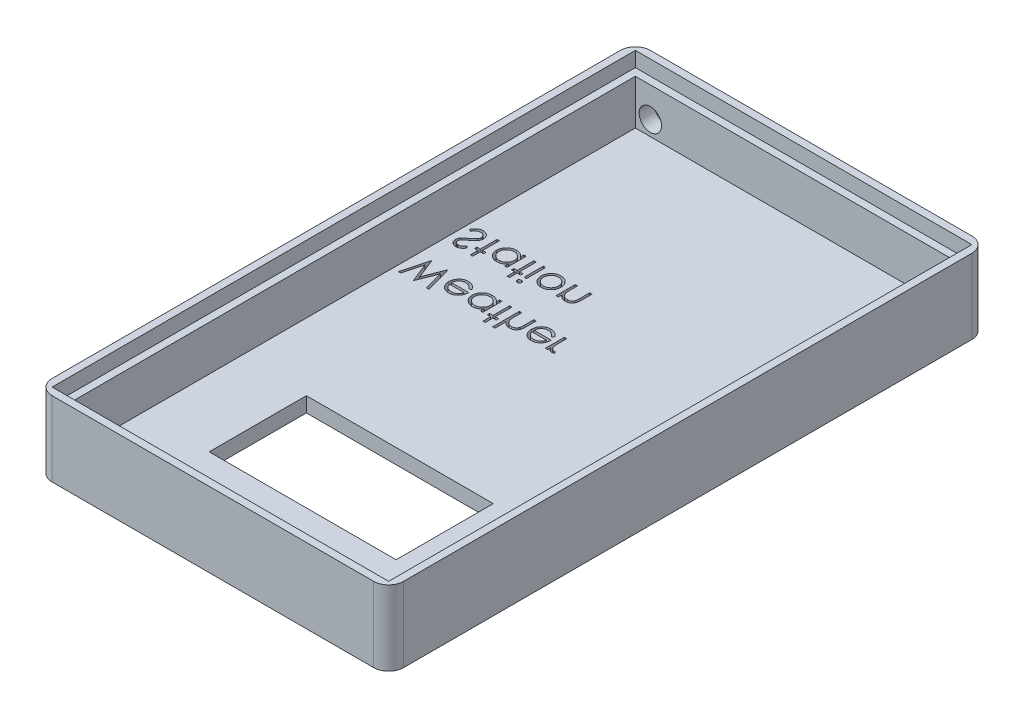
from build123d import *

# Parameters (mm, degrees)
SKETCH1_W           = 47
SKETCH1_H           = 80
BOSS_EXTRUDE1_DEPTH = 10
SKETCH2_W           = 43
SKETCH2_H           = 76
CUT_EXTRUDE1_DEPTH  = 8
SKETCH3_W           = 25
SKETCH3_H           = 13
CUT_EXTRUDE2_DEPTH  = 6
SKETCH4_W           = 45
SKETCH4_H           = 78
SKETCH4_W_2         = 43
SKETCH4_H_2         = 76
CUT_EXTRUDE3_DEPTH  = 2
SKETCH6_W           = 0.314102564
SKETCH6_H           = 2.557692307
CUT_EXTRUDE6_DEPTH  = 2
SKETCH7_R           = 1.5
CUT_EXTRUDE7_DEPTH  = 5
FILLET2_R           = 2


with BuildPart() as part:
    # Sketch1 → Boss-Extrude1 (new body)
    with BuildSketch(Plane(origin=(0, 0, 0), x_dir=(1, 0, 0), z_dir=(0, 1, 0))):
        Rectangle(SKETCH1_W, SKETCH1_H)
    extrude(amount=BOSS_EXTRUDE1_DEPTH)

    # Sketch2 → Cut-Extrude1 (cut)
    with BuildSketch(Plane(origin=(0, 10, 0), x_dir=(1, 0, 0), z_dir=(0, 1, 0))):
        Rectangle(SKETCH2_W, SKETCH2_H)
    extrude(amount=-CUT_EXTRUDE1_DEPTH, mode=Mode.SUBTRACT)

    # Sketch3 → Cut-Extrude2 (cut)
    with BuildSketch(Plane(origin=(0, 2, 0), x_dir=(1, 0, 0), z_dir=(0, 1, 0))):
        with Locations((0, -21.5)):
            Rectangle(SKETCH3_W, SKETCH3_H)
    extrude(amount=-CUT_EXTRUDE2_DEPTH, mode=Mode.SUBTRACT)

    # Sketch4 → Cut-Extrude3 (cut)
    with BuildSketch(Plane(origin=(0, 10, 0), x_dir=(1, 0, 0), z_dir=(0, 1, 0))):
        Rectangle(SKETCH4_W, SKETCH4_H)
        Rectangle(SKETCH4_W_2, SKETCH4_H_2, mode=Mode.SUBTRACT)
    extrude(amount=-CUT_EXTRUDE3_DEPTH, mode=Mode.SUBTRACT)

    # Sketch6 → Cut-Extrude6 (cut)
    # profile 1 of 15: a face of its own
    with BuildSketch(Plane.XZ):
        Polygon((-20.724451657, -5.515410878), (-20.400533388, -5.515410878), (-19.714836272, -8.084321134), (-18.696807426, -5.515410878), (-18.651234509, -5.515410878), (-17.650733708, -8.064689724), (-16.962232106, -5.515410878), (-16.641118323, -5.515410878), (-17.584828259, -9.015410878), (-17.629700054, -9.015410878), (-18.68278499, -6.339930109), (-19.747087875, -9.015410878), (-19.792660791, -9.015410878), align=None)
    # profile 2 of 15: a face of its own
    with BuildSketch(Plane.XZ):
        with BuildLine():
            Line((-14.003498131, -8.20771857), (-13.724451657, -8.354253025))
            add(Edge.make_bspline(
                [(-13.724451657, -8.354253025), (-13.746688252, -8.393696357), (-13.789951861, -8.47043746), (-13.864352608, -8.57586932), (-13.942344681, -8.670717036), (-14.027448649, -8.75244669), (-14.117118328, -8.823698075), (-14.211850983, -8.8860359), (-14.3121398, -8.93915442), (-14.417989525, -8.983906948), (-14.530289076, -9.018316442), (-14.649310593, -9.042620663), (-14.775282088, -9.057643932), (-14.861628268, -9.059389073), (-14.905841881, -9.060282673)],
                knots=[0, 0, 0, 0, 1.120438281, 2.179929193, 3.190490725, 4.156257408, 5.095198341, 6.022838206, 6.959905092, 7.901321166, 8.864066838, 9.862729781, 10.905609505, 12, 12, 12, 12], degree=3))
            add(Edge.make_bspline(
                [(-14.905841881, -9.060282673), (-14.954983859, -9.059135498), (-15.05084562, -9.056897691), (-15.190385367, -9.037605226), (-15.321764786, -9.006132868), (-15.444976489, -8.962167326), (-15.559718742, -8.904740002), (-15.666219597, -8.83478052), (-15.765039122, -8.752648266), (-15.853063332, -8.657631822), (-15.932307214, -8.555949865), (-16.002233034, -8.44999398), (-16.060690465, -8.340030756), (-16.108243076, -8.226760232), (-16.146647941, -8.110896338), (-16.173414644, -7.991384871), (-16.188844392, -7.868549287), (-16.191208838, -7.785451951), (-16.192400375, -7.743575942)],
                knots=[0, 0, 0, 0, 1.145258523, 2.234067595, 3.276747158, 4.290159414, 5.277019952, 6.260822364, 7.254936242, 8.264827045, 9.274100331, 10.257902744, 11.220704747, 12.172965371, 13.118907548, 14.062713208, 15.023725156, 16, 16, 16, 16], degree=3))
            add(Edge.make_bspline(
                [(-16.192400375, -7.743575942), (-16.191341233, -7.704281112), (-16.189242155, -7.626403947), (-16.176011368, -7.511138403), (-16.152563075, -7.39910995), (-16.120386751, -7.290225502), (-16.078835505, -7.184667368), (-16.028003285, -7.082371304), (-15.967810908, -6.983446165), (-15.921338234, -6.921043031), (-15.897929221, -6.889609596)],
                knots=[0, 0, 0, 0, 1.024358464, 2.0301432, 3.019427413, 4.004406732, 4.986367066, 5.972626655, 6.978780325, 8, 8, 8, 8], degree=3))
            add(Edge.make_bspline(
                [(-15.897929221, -6.889609596), (-15.866221538, -6.851740726), (-15.803810592, -6.777202575), (-15.698254236, -6.67926425), (-15.58395404, -6.597220474), (-15.462342414, -6.529213338), (-15.33200594, -6.477539691), (-15.194696649, -6.439032109), (-15.048851062, -6.417454098), (-14.949145842, -6.414406264), (-14.898129541, -6.412846775)],
                knots=[0, 0, 0, 0, 1.030682036, 2.02871468, 2.997146059, 3.962720338, 4.930598197, 5.918074684, 6.934738563, 8, 8, 8, 8], degree=3))
            add(Edge.make_bspline(
                [(-14.898129541, -6.412846775), (-14.845681936, -6.414200824), (-14.74279169, -6.41685716), (-14.592759569, -6.441483493), (-14.450798853, -6.480536048), (-14.316966348, -6.535689838), (-14.191248488, -6.60684939), (-14.074462438, -6.694991231), (-13.964610925, -6.797409319), (-13.900702347, -6.876172528), (-13.868181625, -6.916252224)],
                knots=[0, 0, 0, 0, 1.056321875, 2.072262726, 3.055038591, 4.01806755, 4.982017516, 5.957941055, 6.960871419, 8, 8, 8, 8], degree=3))
            add(Edge.make_bspline(
                [(-13.868181625, -6.916252224), (-13.846054686, -6.946455806), (-13.801948093, -7.006661924), (-13.746700993, -7.104833081), (-13.698743598, -7.207543676), (-13.660410637, -7.316453973), (-13.629371136, -7.430273553), (-13.606914317, -7.549816098), (-13.593744699, -7.675046009), (-13.591156001, -7.760372565), (-13.589836272, -7.803872417)],
                knots=[0, 0, 0, 0, 0.94817472, 1.890038105, 2.849395472, 3.817997239, 4.812318967, 5.836947057, 6.897266129, 8, 8, 8, 8], degree=3))
            Line((-13.589836272, -7.803872417), (-15.878297811, -7.803872417))
            add(Edge.make_bspline(
                [(-15.878297811, -7.803872417), (-15.876758204, -7.837572881), (-15.87373063, -7.903843484), (-15.859615487, -8.000814268), (-15.837366713, -8.09318761), (-15.806097651, -8.180270652), (-15.768230805, -8.263200779), (-15.721845089, -8.341362816), (-15.666505535, -8.414400746), (-15.604779835, -8.482967884), (-15.53607274, -8.544028645), (-15.463789993, -8.598680421), (-15.386896428, -8.644486018), (-15.305998344, -8.681665908), (-15.221226559, -8.710772224), (-15.132554364, -8.730640044), (-15.040156248, -8.743947151), (-14.977170514, -8.745426817), (-14.945104702, -8.746180109)],
                knots=[0, 0, 0, 0, 1.094153842, 2.151609401, 3.174256925, 4.172055639, 5.149267565, 6.128595816, 7.11444997, 8.118368179, 9.117203808, 10.09244225, 11.054858984, 12.015122123, 12.976791628, 13.957293641, 14.960065497, 16, 16, 16, 16], degree=3))
            add(Edge.make_bspline(
                [(-14.945104702, -8.746180109), (-14.913753554, -8.745572052), (-14.851546863, -8.744365551), (-14.758906006, -8.73263364), (-14.667766478, -8.713663365), (-14.578505495, -8.687773374), (-14.492934649, -8.656196522), (-14.413689099, -8.618093665), (-14.340808884, -8.575943918), (-14.272691917, -8.527734243), (-14.206620924, -8.468726056), (-14.141078437, -8.395090335), (-14.070801784, -8.308002807), (-14.026812191, -8.242457141), (-14.003498131, -8.20771857)],
                knots=[0, 0, 0, 0, 0.99110716, 1.966546729, 2.947904876, 3.932708344, 4.903319531, 5.828989031, 6.710028674, 7.56322171, 8.463672341, 9.504779593, 10.677557249, 12, 12, 12, 12], degree=3))
        make_face()
        with BuildLine():
            add(Edge.make_bspline(
                [(-13.903938836, -7.489769852), (-13.915435461, -7.448106979), (-13.937562762, -7.367919358), (-13.983799127, -7.256878468), (-14.035870667, -7.158190567), (-14.097492399, -7.072610934), (-14.167311124, -6.996607421), (-14.247956307, -6.930188835), (-14.338392201, -6.870771384), (-14.438151341, -6.820618885), (-14.543793126, -6.777929026), (-14.654399318, -6.74930391), (-14.767257106, -6.729694368), (-14.843591393, -6.72786826), (-14.88200374, -6.72694934)],
                knots=[0, 0, 0, 0, 1.154881502, 2.222775134, 3.210006277, 4.132804581, 5.035138423, 5.962687519, 6.919655026, 7.923214229, 8.944639381, 9.960483929, 10.97369054, 12, 12, 12, 12], degree=3))
            add(Edge.make_bspline(
                [(-14.88200374, -6.72694934), (-14.913353179, -6.727561011), (-14.975324428, -6.728770157), (-15.066625496, -6.740240287), (-15.154305195, -6.759200131), (-15.239010482, -6.785165088), (-15.319631351, -6.81977369), (-15.397826119, -6.860356917), (-15.471606515, -6.909898501), (-15.517747811, -6.947657356), (-15.541058227, -6.966732993)],
                knots=[0, 0, 0, 0, 1.04873581, 2.073130211, 3.073294108, 4.04793562, 5.032784715, 6.005352987, 6.992311501, 8, 8, 8, 8], degree=3))
            add(Edge.make_bspline(
                [(-15.541058227, -6.966732993), (-15.557751509, -6.981827309), (-15.591534644, -7.012374525), (-15.636675165, -7.065003732), (-15.679895638, -7.121755294), (-15.71922929, -7.184800418), (-15.755306877, -7.253421197), (-15.789066854, -7.327038833), (-15.819453266, -7.406211963), (-15.836549376, -7.461384402), (-15.845345086, -7.489769852)],
                knots=[0, 0, 0, 0, 0.879870761, 1.780643979, 2.707998968, 3.669668524, 4.684282772, 5.740141944, 6.837334558, 8, 8, 8, 8], degree=3))
            Line((-15.845345086, -7.489769852), (-13.903938836, -7.489769852))
        make_face(mode=Mode.SUBTRACT)
    # profile 3 of 15: a face of its own
    with BuildSketch(Plane.XZ):
        with BuildLine():
            Line((-10.359067041, -6.45771857), (-10.359067041, -9.015410878))
            Line((-10.359067041, -9.015410878), (-10.673169606, -9.015410878))
            Line((-10.673169606, -9.015410878), (-10.673169606, -8.573003025))
            add(Edge.make_bspline(
                [(-10.673169606, -8.573003025), (-10.708588396, -8.613042619), (-10.777708611, -8.691180391), (-10.893149729, -8.793262563), (-11.015517907, -8.877640885), (-11.144219228, -8.9457908), (-11.279137472, -8.996982857), (-11.419973559, -9.033369016), (-11.56678494, -9.056762851), (-11.667037295, -9.059098873), (-11.71784108, -9.060282673)],
                knots=[0, 0, 0, 0, 1.074387032, 2.096679803, 3.090159297, 4.057316773, 5.018401886, 5.985159533, 6.978961417, 8, 8, 8, 8], degree=3))
            add(Edge.make_bspline(
                [(-11.71784108, -9.060282673), (-11.763009034, -9.059056301), (-11.852082239, -9.05663784), (-11.983111316, -9.037875537), (-12.109203565, -9.007744915), (-12.230478138, -8.965844025), (-12.346150283, -8.910263204), (-12.45721038, -8.843721956), (-12.563083072, -8.764481126), (-12.662154611, -8.673893097), (-12.753386611, -8.57549811), (-12.833447884, -8.470552563), (-12.900200964, -8.359510259), (-12.956021045, -8.243777106), (-12.999017389, -8.122462186), (-13.028991023, -7.995985018), (-13.04773147, -7.864495145), (-13.050148931, -7.774955621), (-13.051374734, -7.729553506)],
                knots=[0, 0, 0, 0, 1.033919861, 2.038935746, 3.024066025, 3.998881131, 4.97069526, 5.957263378, 6.95902576, 7.993208707, 9.027059324, 10.027763471, 11.009749337, 11.988697705, 12.965288445, 13.950418724, 14.960734635, 16, 16, 16, 16], degree=3))
            add(Edge.make_bspline(
                [(-13.051374734, -7.729553506), (-13.050121762, -7.685089803), (-13.047644706, -7.597187459), (-13.029191486, -7.467908761), (-12.998160477, -7.343390501), (-12.954612629, -7.224033557), (-12.898770674, -7.109693507), (-12.830842587, -7.000289482), (-12.750823463, -6.895520085), (-12.658571056, -6.797848858), (-12.558636285, -6.707628244), (-12.451727555, -6.629219198), (-12.340504273, -6.561502349), (-12.223241263, -6.507848873), (-12.101674158, -6.464439769), (-11.974720712, -6.4344068), (-11.842909133, -6.416709479), (-11.753418641, -6.414146715), (-11.708025375, -6.412846775)],
                knots=[0, 0, 0, 0, 1.020392517, 2.01726096, 2.990465484, 3.961182959, 4.928053699, 5.906110375, 6.912531644, 7.948652711, 8.985773172, 9.998621852, 10.987621588, 11.969261332, 12.953316658, 13.946091881, 14.958173133, 16, 16, 16, 16], degree=3))
            add(Edge.make_bspline(
                [(-11.708025375, -6.412846775), (-11.655825516, -6.414284527), (-11.553464056, -6.41710389), (-11.403736046, -6.440566617), (-11.262091569, -6.480205084), (-11.127437217, -6.534122582), (-11.00025653, -6.605771312), (-10.881753546, -6.696151273), (-10.770688063, -6.80469246), (-10.706307771, -6.888062904), (-10.673169606, -6.930975782)],
                knots=[0, 0, 0, 0, 1.038897134, 2.037228247, 3.008116434, 3.962042015, 4.918381754, 5.904844433, 6.921570401, 8, 8, 8, 8], degree=3))
            Line((-10.673169606, -6.930975782), (-10.673169606, -6.45771857))
            Line((-10.673169606, -6.45771857), (-10.359067041, -6.45771857))
        make_face()
        with BuildLine():
            add(Edge.make_bspline(
                [(-11.703818644, -6.72694934), (-11.749732982, -6.728582977), (-11.840360582, -6.731807518), (-11.973404584, -6.756981014), (-12.100717998, -6.798865608), (-12.221664072, -6.856147509), (-12.334332289, -6.928176246), (-12.43502596, -7.015297629), (-12.524568661, -7.115134643), (-12.599876925, -7.227236754), (-12.661267422, -7.347414845), (-12.704434454, -7.473039283), (-12.732903702, -7.60184426), (-12.735812222, -7.689206946), (-12.73727217, -7.733059115)],
                knots=[0, 0, 0, 0, 1.031046209, 2.035121221, 3.029706178, 4.034933723, 5.034054252, 6.02443088, 7.017295772, 8.038157696, 9.050218397, 10.03989886, 11.016116709, 12, 12, 12, 12], degree=3))
            add(Edge.make_bspline(
                [(-12.73727217, -7.733059115), (-12.735407276, -7.776649222), (-12.731684799, -7.863658578), (-12.704934105, -7.992639155), (-12.660054232, -8.118293197), (-12.598812169, -8.239554191), (-12.522125544, -8.352138291), (-12.433236892, -8.453878414), (-12.33128661, -8.541368002), (-12.218359103, -8.614605575), (-12.097751133, -8.673768096), (-11.970917201, -8.714933736), (-11.840241563, -8.741511516), (-11.751389229, -8.744615993), (-11.706623131, -8.746180109)],
                knots=[0, 0, 0, 0, 0.979072187, 1.954306742, 2.945804271, 3.96968567, 4.997920485, 5.998718438, 6.996577872, 8.005894225, 9.015743152, 10.005417472, 10.995077863, 12, 12, 12, 12], degree=3))
            add(Edge.make_bspline(
                [(-11.706623131, -8.746180109), (-11.661176628, -8.744520145), (-11.570788042, -8.741218641), (-11.437349334, -8.715937376), (-11.307854371, -8.674168578), (-11.184067143, -8.616269451), (-11.068751012, -8.544512095), (-10.965253134, -8.460505004), (-10.877737166, -8.36280182), (-10.803544556, -8.255425367), (-10.745369139, -8.13771337), (-10.70299308, -8.01237918), (-10.677939174, -7.879418431), (-10.674781445, -7.788554504), (-10.673169606, -7.742173699)],
                knots=[0, 0, 0, 0, 1.01762866, 2.023962475, 3.030623092, 4.058876274, 5.077231937, 6.066672613, 7.034107872, 8.005628644, 8.981990164, 9.965428785, 10.961468474, 12, 12, 12, 12], degree=3))
            add(Edge.make_bspline(
                [(-10.673169606, -7.742173699), (-10.674129262, -7.706835868), (-10.676018169, -7.637279835), (-10.690448739, -7.535152317), (-10.713403665, -7.437418591), (-10.745749835, -7.343975902), (-10.78824112, -7.255340887), (-10.839488886, -7.170877126), (-10.900394335, -7.091023915), (-10.969977031, -7.016880844), (-11.046142234, -6.949254382), (-11.126736775, -6.888890141), (-11.212715522, -6.839301368), (-11.302632558, -6.798260097), (-11.396643893, -6.765600947), (-11.495514513, -6.743813253), (-11.5981935, -6.728852932), (-11.668239555, -6.727590551), (-11.703818644, -6.72694934)],
                knots=[0, 0, 0, 0, 1.050140795, 2.067009409, 3.05949893, 4.030605086, 5.00011959, 5.97591094, 6.962425594, 7.979863591, 8.993523472, 9.986985069, 10.967611495, 11.937549037, 12.921786183, 13.919465291, 14.943216303, 16, 16, 16, 16], degree=3))
        make_face(mode=Mode.SUBTRACT)
    # profile 4 of 15: a face of its own
    with BuildSketch(Plane.XZ):
        Polygon((-9.327015759, -5.425667288), (-9.012913195, -5.425667288), (-9.012913195, -6.45771857), (-8.564195247, -6.45771857), (-8.564195247, -6.771821134), (-9.012913195, -6.771821134), (-9.012913195, -9.015410878), (-9.327015759, -9.015410878), (-9.327015759, -6.771821134), (-9.775733708, -6.771821134), (-9.775733708, -6.45771857), (-9.327015759, -6.45771857), align=None)
    # profile 5 of 15: a face of its own
    with BuildSketch(Plane.XZ):
        with BuildLine():
            Line((-8.025733708, -5.425667288), (-7.711631144, -5.425667288))
            Line((-7.711631144, -5.425667288), (-7.711631144, -6.940791487))
            add(Edge.make_bspline(
                [(-7.711631144, -6.940791487), (-7.677913842, -6.898647505), (-7.612264528, -6.816591012), (-7.501768412, -6.709529821), (-7.38829754, -6.6167312), (-7.26793273, -6.542860743), (-7.142882209, -6.4845042), (-7.012618565, -6.443116553), (-6.877117594, -6.417665457), (-6.785092444, -6.414467039), (-6.738474093, -6.412846775)],
                knots=[0, 0, 0, 0, 1.125788106, 2.19196713, 3.20547328, 4.180437432, 5.132270164, 6.079753143, 7.027236121, 8, 8, 8, 8], degree=3))
            add(Edge.make_bspline(
                [(-6.738474093, -6.412846775), (-6.6911437, -6.414592206), (-6.598506704, -6.418008434), (-6.463625242, -6.445021815), (-6.337664367, -6.491179253), (-6.220998524, -6.554346278), (-6.116173827, -6.633019105), (-6.023324063, -6.723850628), (-5.947483264, -6.829124546), (-5.895884147, -6.9263808), (-5.862310739, -7.012919554), (-5.841058913, -7.087156066), (-5.823039714, -7.169877979), (-5.807339979, -7.261042712), (-5.796876397, -7.361087883), (-5.788471779, -7.469562138), (-5.782495325, -7.586459256), (-5.78226372, -7.667379505), (-5.782143965, -7.709220974)],
                knots=[0, 0, 0, 0, 1.235656852, 2.418478516, 3.575258207, 4.727955599, 5.870717718, 6.98870536, 8.107142894, 9.245821548, 9.854588956, 10.528768408, 11.260415777, 12.065282286, 12.943670737, 13.886611085, 14.907229059, 16, 16, 16, 16], degree=3))
            Line((-5.782143965, -7.709220974), (-5.782143965, -9.015410878))
            Line((-5.782143965, -9.015410878), (-6.096246529, -9.015410878))
            Line((-6.096246529, -9.015410878), (-6.096246529, -7.812285878))
            add(Edge.make_bspline(
                [(-6.096246529, -7.812285878), (-6.096436832, -7.777463209), (-6.096800849, -7.710853368), (-6.098004194, -7.61548726), (-6.100690409, -7.528991125), (-6.105031235, -7.451642173), (-6.109596542, -7.38333257), (-6.11587986, -7.324161516), (-6.123190094, -7.27404774), (-6.129758875, -7.243883112), (-6.132704862, -7.230354788)],
                knots=[0, 0, 0, 0, 1.430932559, 2.737130458, 3.918967929, 4.986496826, 5.920444988, 6.731744033, 7.431208747, 8, 8, 8, 8], degree=3))
            add(Edge.make_bspline(
                [(-6.132704862, -7.230354788), (-6.144129107, -7.190660525), (-6.166092152, -7.114348534), (-6.217140129, -7.010686124), (-6.28089914, -6.922301383), (-6.358746402, -6.850387095), (-6.449304766, -6.793975556), (-6.55316473, -6.754907773), (-6.669348798, -6.730660051), (-6.75120027, -6.728220748), (-6.793862715, -6.72694934)],
                knots=[0, 0, 0, 0, 1.090059168, 2.095632401, 3.037101401, 3.955032261, 4.878929692, 5.839099886, 6.873700383, 8, 8, 8, 8], degree=3))
            add(Edge.make_bspline(
                [(-6.793862715, -6.72694934), (-6.819130488, -6.727425166), (-6.869134758, -6.728366814), (-6.943283424, -6.737820712), (-7.015212487, -6.753269431), (-7.085614665, -6.77417397), (-7.152997863, -6.802619506), (-7.219326188, -6.835549696), (-7.282720397, -6.875857951), (-7.344306214, -6.921083718), (-7.401623747, -6.971153478), (-7.454950862, -7.024000433), (-7.502489203, -7.080275397), (-7.545557794, -7.139075513), (-7.582736079, -7.201207306), (-7.615189161, -7.266071625), (-7.642724858, -7.33375377), (-7.65640755, -7.380728832), (-7.66325374, -7.404232993)],
                knots=[0, 0, 0, 0, 1.024319606, 2.027102035, 3.025350316, 4.005802111, 5.00026367, 5.987881639, 7.005602596, 8.042517216, 9.083927026, 10.089214625, 11.084353441, 12.06828073, 13.041928858, 14.016821737, 15.00770877, 16, 16, 16, 16], degree=3))
            add(Edge.make_bspline(
                [(-7.66325374, -7.404232993), (-7.667193167, -7.421253944), (-7.675777664, -7.458344691), (-7.685092497, -7.519519015), (-7.693430294, -7.590605387), (-7.700478844, -7.671495988), (-7.70480193, -7.76248723), (-7.709460171, -7.862958189), (-7.711194185, -7.97353821), (-7.711481138, -8.050433717), (-7.711631144, -8.090631231)],
                knots=[0, 0, 0, 0, 0.607992626, 1.324890765, 2.152360218, 3.099583803, 4.150613268, 5.323148443, 6.60066238, 8, 8, 8, 8], degree=3))
            Line((-7.711631144, -8.090631231), (-7.711631144, -9.015410878))
            Line((-7.711631144, -9.015410878), (-8.025733708, -9.015410878))
            Line((-8.025733708, -9.015410878), (-8.025733708, -5.425667288))
        make_face()
    # profile 6 of 15: a face of its own
    with BuildSketch(Plane.XZ):
        with BuildLine():
            Line((-2.965036593, -8.20771857), (-2.685990118, -8.354253025))
            add(Edge.make_bspline(
                [(-2.685990118, -8.354253025), (-2.708226714, -8.393696357), (-2.751490322, -8.47043746), (-2.82589107, -8.57586932), (-2.903883143, -8.670717036), (-2.988987111, -8.75244669), (-3.078656789, -8.823698075), (-3.173389444, -8.8860359), (-3.273678262, -8.93915442), (-3.379527987, -8.983906948), (-3.491827538, -9.018316442), (-3.610849054, -9.042620663), (-3.73682055, -9.057643932), (-3.82316673, -9.059389073), (-3.867380343, -9.060282673)],
                knots=[0, 0, 0, 0, 1.120438281, 2.179929193, 3.190490725, 4.156257408, 5.095198341, 6.022838206, 6.959905092, 7.901321166, 8.864066838, 9.862729781, 10.905609505, 12, 12, 12, 12], degree=3))
            add(Edge.make_bspline(
                [(-3.867380343, -9.060282673), (-3.91652232, -9.059135498), (-4.012384082, -9.056897691), (-4.151923829, -9.037605226), (-4.283303247, -9.006132868), (-4.406514951, -8.962167326), (-4.521257203, -8.904740002), (-4.627758058, -8.83478052), (-4.726577584, -8.752648266), (-4.814601793, -8.657631822), (-4.893845676, -8.555949865), (-4.963771496, -8.44999398), (-5.022228927, -8.340030756), (-5.069781537, -8.226760232), (-5.108186402, -8.110896338), (-5.134953106, -7.991384871), (-5.150382854, -7.868549287), (-5.152747299, -7.785451951), (-5.153938836, -7.743575942)],
                knots=[0, 0, 0, 0, 1.145258523, 2.234067595, 3.276747158, 4.290159414, 5.277019952, 6.260822364, 7.254936242, 8.264827045, 9.274100331, 10.257902744, 11.220704747, 12.172965371, 13.118907548, 14.062713208, 15.023725156, 16, 16, 16, 16], degree=3))
            add(Edge.make_bspline(
                [(-5.153938836, -7.743575942), (-5.152879695, -7.704281112), (-5.150780617, -7.626403947), (-5.137549829, -7.511138403), (-5.114101536, -7.39910995), (-5.081925212, -7.290225502), (-5.040373966, -7.184667368), (-4.989541747, -7.082371304), (-4.929349369, -6.983446165), (-4.882876695, -6.921043031), (-4.859467682, -6.889609596)],
                knots=[0, 0, 0, 0, 1.024358464, 2.0301432, 3.019427413, 4.004406732, 4.986367066, 5.972626655, 6.978780325, 8, 8, 8, 8], degree=3))
            add(Edge.make_bspline(
                [(-4.859467682, -6.889609596), (-4.82776, -6.851740726), (-4.765349053, -6.777202575), (-4.659792698, -6.67926425), (-4.545492501, -6.597220474), (-4.423880875, -6.529213338), (-4.293544401, -6.477539691), (-4.15623511, -6.439032109), (-4.010389524, -6.417454098), (-3.910684303, -6.414406264), (-3.859668003, -6.412846775)],
                knots=[0, 0, 0, 0, 1.030682036, 2.02871468, 2.997146059, 3.962720338, 4.930598197, 5.918074684, 6.934738563, 8, 8, 8, 8], degree=3))
            add(Edge.make_bspline(
                [(-3.859668003, -6.412846775), (-3.807220398, -6.414200824), (-3.704330152, -6.41685716), (-3.554298031, -6.441483493), (-3.412337314, -6.480536048), (-3.27850481, -6.535689838), (-3.152786949, -6.60684939), (-3.0360009, -6.694991231), (-2.926149387, -6.797409319), (-2.862240808, -6.876172528), (-2.829720086, -6.916252224)],
                knots=[0, 0, 0, 0, 1.056321875, 2.072262726, 3.055038591, 4.01806755, 4.982017516, 5.957941055, 6.960871419, 8, 8, 8, 8], degree=3))
            add(Edge.make_bspline(
                [(-2.829720086, -6.916252224), (-2.807593148, -6.946455806), (-2.763486555, -7.006661924), (-2.708239455, -7.104833081), (-2.66028206, -7.207543676), (-2.621949099, -7.316453973), (-2.590909598, -7.430273553), (-2.568452779, -7.549816098), (-2.55528316, -7.675046009), (-2.552694463, -7.760372565), (-2.551374734, -7.803872417)],
                knots=[0, 0, 0, 0, 0.94817472, 1.890038105, 2.849395472, 3.817997239, 4.812318967, 5.836947057, 6.897266129, 8, 8, 8, 8], degree=3))
            Line((-2.551374734, -7.803872417), (-4.839836272, -7.803872417))
            add(Edge.make_bspline(
                [(-4.839836272, -7.803872417), (-4.838296666, -7.837572881), (-4.835269092, -7.903843484), (-4.821153949, -8.000814268), (-4.798905175, -8.09318761), (-4.767636112, -8.180270652), (-4.729769267, -8.263200779), (-4.68338355, -8.341362816), (-4.628043996, -8.414400746), (-4.566318297, -8.482967884), (-4.497611202, -8.544028645), (-4.425328454, -8.598680421), (-4.348434889, -8.644486018), (-4.267536806, -8.681665908), (-4.182765021, -8.710772224), (-4.094092826, -8.730640044), (-4.001694709, -8.743947151), (-3.938708975, -8.745426817), (-3.906643163, -8.746180109)],
                knots=[0, 0, 0, 0, 1.094153842, 2.151609401, 3.174256925, 4.172055639, 5.149267565, 6.128595816, 7.11444997, 8.118368179, 9.117203808, 10.09244225, 11.054858984, 12.015122123, 12.976791628, 13.957293641, 14.960065497, 16, 16, 16, 16], degree=3))
            add(Edge.make_bspline(
                [(-3.906643163, -8.746180109), (-3.875292016, -8.745572052), (-3.813085325, -8.744365551), (-3.720444467, -8.73263364), (-3.62930494, -8.713663365), (-3.540043957, -8.687773374), (-3.454473111, -8.656196522), (-3.375227561, -8.618093665), (-3.302347345, -8.575943918), (-3.234230378, -8.527734243), (-3.168159385, -8.468726056), (-3.102616899, -8.395090335), (-3.032340245, -8.308002807), (-2.988350653, -8.242457141), (-2.965036593, -8.20771857)],
                knots=[0, 0, 0, 0, 0.99110716, 1.966546729, 2.947904876, 3.932708344, 4.903319531, 5.828989031, 6.710028674, 7.56322171, 8.463672341, 9.504779593, 10.677557249, 12, 12, 12, 12], degree=3))
        make_face()
        with BuildLine():
            add(Edge.make_bspline(
                [(-2.865477298, -7.489769852), (-2.876973922, -7.448106979), (-2.899101224, -7.367919358), (-2.945337588, -7.256878468), (-2.997409129, -7.158190567), (-3.05903086, -7.072610934), (-3.128849586, -6.996607421), (-3.209494769, -6.930188835), (-3.299930662, -6.870771384), (-3.399689803, -6.820618885), (-3.505331588, -6.777929026), (-3.61593778, -6.74930391), (-3.728795568, -6.729694368), (-3.805129854, -6.72786826), (-3.843542202, -6.72694934)],
                knots=[0, 0, 0, 0, 1.154881502, 2.222775134, 3.210006277, 4.132804581, 5.035138423, 5.962687519, 6.919655026, 7.923214229, 8.944639381, 9.960483929, 10.97369054, 12, 12, 12, 12], degree=3))
            add(Edge.make_bspline(
                [(-3.843542202, -6.72694934), (-3.87489164, -6.727561011), (-3.936862889, -6.728770157), (-4.028163957, -6.740240287), (-4.115843656, -6.759200131), (-4.200548944, -6.785165088), (-4.281169812, -6.81977369), (-4.359364581, -6.860356917), (-4.433144977, -6.909898501), (-4.479286272, -6.947657356), (-4.502596689, -6.966732993)],
                knots=[0, 0, 0, 0, 1.04873581, 2.073130211, 3.073294108, 4.04793562, 5.032784715, 6.005352987, 6.992311501, 8, 8, 8, 8], degree=3))
            add(Edge.make_bspline(
                [(-4.502596689, -6.966732993), (-4.519289971, -6.981827309), (-4.553073105, -7.012374525), (-4.598213627, -7.065003732), (-4.641434099, -7.121755294), (-4.680767752, -7.184800418), (-4.716845338, -7.253421197), (-4.750605316, -7.327038833), (-4.780991728, -7.406211963), (-4.798087838, -7.461384402), (-4.806883548, -7.489769852)],
                knots=[0, 0, 0, 0, 0.879870761, 1.780643979, 2.707998968, 3.669668524, 4.684282772, 5.740141944, 6.837334558, 8, 8, 8, 8], degree=3))
            Line((-4.806883548, -7.489769852), (-2.865477298, -7.489769852))
        make_face(mode=Mode.SUBTRACT)
    # profile 7 of 15: a face of its own
    with BuildSketch(Plane.XZ):
        with BuildLine():
            Line((-2.012913195, -6.45771857), (-1.698810631, -6.45771857))
            Line((-1.698810631, -6.45771857), (-1.698810631, -6.834220974))
            add(Edge.make_bspline(
                [(-1.698810631, -6.834220974), (-1.675621872, -6.799165146), (-1.631273551, -6.732121147), (-1.557560622, -6.643451846), (-1.482057291, -6.570036799), (-1.404402104, -6.51153328), (-1.324024004, -6.467720161), (-1.242687052, -6.435627126), (-1.159111582, -6.416649811), (-1.102949658, -6.414116152), (-1.074812234, -6.412846775)],
                knots=[0, 0, 0, 0, 1.2804753, 2.448899062, 3.506932113, 4.484331642, 5.4025378, 6.288909075, 7.142734305, 8, 8, 8, 8], degree=3))
            add(Edge.make_bspline(
                [(-1.074812234, -6.412846775), (-1.052985907, -6.414037302), (-1.008076822, -6.416486888), (-0.940094232, -6.433697713), (-0.87005078, -6.461175735), (-0.824908393, -6.487015958), (-0.801374734, -6.500487)],
                knots=[0, 0, 0, 0, 0.901110191, 1.854092781, 2.881294221, 4, 4, 4, 4], degree=3))
            Line((-0.801374734, -6.500487), (-0.973850695, -6.772522256))
            add(Edge.make_bspline(
                [(-0.973850695, -6.772522256), (-0.988959716, -6.76578199), (-1.017639531, -6.752987675), (-1.059594097, -6.737845665), (-1.098275434, -6.728929749), (-1.122918992, -6.727579031), (-1.134407586, -6.72694934)],
                knots=[0, 0, 0, 0, 1.180555205, 2.24091978, 3.179933427, 4, 4, 4, 4], degree=3))
            add(Edge.make_bspline(
                [(-1.134407586, -6.72694934), (-1.15961332, -6.728629377), (-1.21102571, -6.732056166), (-1.286510209, -6.758994974), (-1.359757415, -6.802520214), (-1.417929077, -6.850791326), (-1.46297133, -6.897339123), (-1.495111555, -6.937987526), (-1.524594302, -6.983566157), (-1.552764523, -7.033295841), (-1.578430817, -7.088025687), (-1.602385486, -7.147208901), (-1.624044349, -7.21091403), (-1.636394593, -7.25529655), (-1.642720888, -7.27803107)],
                knots=[0, 0, 0, 0, 1.125678352, 2.296057538, 3.5422874, 4.923748041, 5.663163013, 6.437101912, 7.23742474, 8.08941207, 8.991984279, 9.93940061, 10.944477711, 12, 12, 12, 12], degree=3))
            add(Edge.make_bspline(
                [(-1.642720888, -7.27803107), (-1.647453281, -7.298308244), (-1.657935173, -7.343220643), (-1.66812671, -7.418569167), (-1.678196228, -7.507592826), (-1.685292847, -7.610539419), (-1.691870889, -7.727151863), (-1.695580971, -7.857607808), (-1.698684112, -8.00204116), (-1.698767179, -8.103015513), (-1.698810631, -8.155835558)],
                knots=[0, 0, 0, 0, 0.566838948, 1.255505196, 2.06880316, 3.007127437, 4.065329342, 5.249902469, 6.561414163, 8, 8, 8, 8], degree=3))
            Line((-1.698810631, -8.155835558), (-1.698810631, -9.015410878))
            Line((-1.698810631, -9.015410878), (-2.012913195, -9.015410878))
            Line((-2.012913195, -9.015410878), (-2.012913195, -6.45771857))
        make_face()
    # profile 8 of 15: a face of its own
    with BuildSketch(Plane.XZ):
        with BuildLine():
            Line((-20.859067041, -15.173563923), (-20.563193644, -14.996180109))
            add(Edge.make_bspline(
                [(-20.563193644, -14.996180109), (-20.535675407, -15.042244494), (-20.482951526, -15.130502078), (-20.395000167, -15.249760118), (-20.303867256, -15.351122275), (-20.208877922, -15.433998882), (-20.110611974, -15.499247769), (-20.00842792, -15.545450001), (-19.90267011, -15.574265976), (-19.830696288, -15.577766063), (-19.794764157, -15.579513442)],
                knots=[0, 0, 0, 0, 1.272034388, 2.437168799, 3.508375237, 4.49857839, 5.41946034, 6.295179144, 7.148887113, 8, 8, 8, 8], degree=3))
            add(Edge.make_bspline(
                [(-19.794764157, -15.579513442), (-19.764077296, -15.57865877), (-19.703240523, -15.576964379), (-19.61367828, -15.560683577), (-19.526696478, -15.535671448), (-19.44408784, -15.499850517), (-19.366992226, -15.456512031), (-19.29938553, -15.404165854), (-19.240939417, -15.345559648), (-19.193130303, -15.280176993), (-19.156450267, -15.209859845), (-19.128258199, -15.137683893), (-19.112613125, -15.062515325), (-19.110256372, -15.011904862), (-19.109067041, -14.986364404)],
                knots=[0, 0, 0, 0, 1.095163259, 2.171163733, 3.241058638, 4.321873601, 5.38011039, 6.391990106, 7.366004449, 8.327778327, 9.272591725, 10.192022065, 11.087607919, 12, 12, 12, 12], degree=3))
            add(Edge.make_bspline(
                [(-19.109067041, -14.986364404), (-19.110541352, -14.957223554), (-19.11353841, -14.897984465), (-19.13886989, -14.810584812), (-19.178719137, -14.724092242), (-19.215481781, -14.670590976), (-19.234567843, -14.642814724)],
                knots=[0, 0, 0, 0, 0.938893495, 1.908633276, 2.914225137, 4, 4, 4, 4], degree=3))
            add(Edge.make_bspline(
                [(-19.234567843, -14.642814724), (-19.250238457, -14.622767901), (-19.283136951, -14.580682102), (-19.339694464, -14.518036867), (-19.406060578, -14.453418448), (-19.479964133, -14.384359391), (-19.564097222, -14.314071594), (-19.655824736, -14.239203316), (-19.757488595, -14.162601739), (-19.828788092, -14.111229173), (-19.865577458, -14.084721775)],
                knots=[0, 0, 0, 0, 0.722233717, 1.516239348, 2.393582979, 3.351407094, 4.387010283, 5.505090956, 6.712668013, 8, 8, 8, 8], degree=3))
            add(Edge.make_bspline(
                [(-19.865577458, -14.084721775), (-19.902401454, -14.058493188), (-19.972806131, -14.008346126), (-20.071264713, -13.933921842), (-20.159309176, -13.865877972), (-20.236548193, -13.80357396), (-20.30294779, -13.747001355), (-20.359031201, -13.696703416), (-20.403369758, -13.651319855), (-20.428025338, -13.621878513), (-20.439095086, -13.608660077)],
                knots=[0, 0, 0, 0, 1.452282411, 2.77665338, 3.964542531, 5.026858415, 5.96415736, 6.766646006, 7.446254459, 8, 8, 8, 8], degree=3))
            add(Edge.make_bspline(
                [(-20.439095086, -13.608660077), (-20.454567632, -13.58805904), (-20.484996468, -13.547544336), (-20.525162474, -13.484219478), (-20.559301637, -13.419396213), (-20.586063969, -13.352900348), (-20.608600187, -13.28566542), (-20.623758118, -13.216814174), (-20.633249515, -13.146655555), (-20.634221502, -13.099442055), (-20.634708067, -13.075807513)],
                knots=[0, 0, 0, 0, 1.068054152, 2.10047183, 3.106115577, 4.101338837, 5.06977816, 6.043150881, 7.020423561, 8, 8, 8, 8], degree=3))
            add(Edge.make_bspline(
                [(-20.634708067, -13.075807513), (-20.633402858, -13.038777738), (-20.630820338, -12.965509674), (-20.608979821, -12.858478844), (-20.574506927, -12.756292427), (-20.526212039, -12.659962093), (-20.463954686, -12.571996112), (-20.391908712, -12.491382625), (-20.306097226, -12.423614043), (-20.211944602, -12.364401984), (-20.10888823, -12.318056059), (-20.000897327, -12.283095079), (-19.887800255, -12.263285821), (-19.81119712, -12.260443057), (-19.772328259, -12.259000622)],
                knots=[0, 0, 0, 0, 1.005424448, 1.989358655, 2.955360095, 3.929531133, 4.905563448, 5.876582895, 6.856512386, 7.866279853, 8.892233794, 9.918561126, 10.94386622, 12, 12, 12, 12], degree=3))
            add(Edge.make_bspline(
                [(-19.772328259, -12.259000622), (-19.731084159, -12.260423173), (-19.649062807, -12.263252174), (-19.528413592, -12.287849706), (-19.412252875, -12.328550377), (-19.318809611, -12.374739035), (-19.245676849, -12.420870451), (-19.189904116, -12.462890275), (-19.133386666, -12.511265384), (-19.075668611, -12.56612463), (-19.017727951, -12.627971381), (-18.958704499, -12.69638207), (-18.89846023, -12.770938626), (-18.85970437, -12.824163127), (-18.839836272, -12.851448538)],
                knots=[0, 0, 0, 0, 1.286793592, 2.559021753, 3.825965368, 5.121522368, 5.803751409, 6.523245864, 7.299691795, 8.125521123, 9.008227632, 9.944561021, 10.946284179, 12, 12, 12, 12], degree=3))
            Line((-18.839836272, -12.851448538), (-19.123790599, -13.066692929))
            add(Edge.make_bspline(
                [(-19.123790599, -13.066692929), (-19.140936532, -13.044604239), (-19.173955589, -13.002066586), (-19.224085076, -12.94249527), (-19.271333723, -12.888078791), (-19.317884123, -12.840813663), (-19.361277755, -12.798111529), (-19.403394797, -12.761551772), (-19.443629148, -12.730776177), (-19.494346059, -12.697932617), (-19.558063777, -12.665376113), (-19.638048313, -12.637827035), (-19.721634588, -12.621271973), (-19.77856422, -12.619083086), (-19.807384349, -12.617974981)],
                knots=[0, 0, 0, 0, 1.181633172, 2.275549214, 3.290209073, 4.226197932, 5.078386478, 5.862611352, 6.581680152, 7.217281963, 8.414376989, 9.595101626, 10.782541182, 12, 12, 12, 12], degree=3))
            add(Edge.make_bspline(
                [(-19.807384349, -12.617974981), (-19.843540872, -12.619186681), (-19.913265319, -12.62152333), (-20.012255555, -12.647043315), (-20.10134948, -12.687225175), (-20.177902045, -12.743540153), (-20.241639022, -12.810261146), (-20.287744481, -12.887040001), (-20.315494646, -12.971822404), (-20.318880925, -13.03096406), (-20.320605503, -13.061083955)],
                knots=[0, 0, 0, 0, 1.14458467, 2.207223713, 3.21896685, 4.227309161, 5.202851033, 6.127160689, 7.046193047, 8, 8, 8, 8], degree=3))
            add(Edge.make_bspline(
                [(-20.320605503, -13.061083955), (-20.320212376, -13.079835434), (-20.31942548, -13.117369053), (-20.308450683, -13.172820475), (-20.294351354, -13.228131814), (-20.272008722, -13.283054397), (-20.241163418, -13.338548756), (-20.200658242, -13.395570494), (-20.14964493, -13.454622202), (-20.110567918, -13.493029576), (-20.089936432, -13.513307513)],
                knots=[0, 0, 0, 0, 0.858281714, 1.717966888, 2.583508476, 3.4729293, 4.427298488, 5.488583878, 6.674047936, 8, 8, 8, 8], degree=3))
            add(Edge.make_bspline(
                [(-20.089936432, -13.513307513), (-20.08227506, -13.520144538), (-20.064073393, -13.536387747), (-20.030797467, -13.562980027), (-19.986854669, -13.5957828), (-19.933392468, -13.636370116), (-19.869425106, -13.683451578), (-19.79494555, -13.73642519), (-19.710784017, -13.79701065), (-19.651062101, -13.83936819), (-19.619483708, -13.861765045)],
                knots=[0, 0, 0, 0, 0.420754252, 0.999615792, 1.744751191, 2.668019286, 3.750313428, 4.999500688, 6.413464383, 8, 8, 8, 8], degree=3))
            add(Edge.make_bspline(
                [(-19.619483708, -13.861765045), (-19.581497795, -13.889406404), (-19.507943338, -13.942930066), (-19.403285758, -14.023345746), (-19.30839195, -14.101993515), (-19.222928747, -14.178371122), (-19.146051838, -14.251899215), (-19.078614118, -14.323462395), (-19.019928437, -14.392547968), (-18.956749219, -14.481120543), (-18.892191399, -14.589901628), (-18.836749892, -14.723179866), (-18.801791545, -14.856976187), (-18.797220029, -14.946903023), (-18.794964477, -14.991272256)],
                knots=[0, 0, 0, 0, 1.163667725, 2.253281268, 3.268753668, 4.215851969, 5.092017293, 5.902905408, 6.650798638, 7.335211899, 8.59617414, 9.77448103, 10.901945474, 12, 12, 12, 12], degree=3))
            add(Edge.make_bspline(
                [(-18.794964477, -14.991272256), (-18.795621615, -15.022650621), (-18.796923131, -15.084798005), (-18.811884044, -15.176053082), (-18.833803709, -15.264683951), (-18.866840943, -15.349595064), (-18.907164102, -15.432339827), (-18.95833035, -15.510747727), (-19.017638034, -15.586554126), (-19.085671799, -15.657737617), (-19.160117701, -15.723083813), (-19.238801396, -15.781212874), (-19.321851669, -15.829681198), (-19.408817986, -15.86923204), (-19.499720322, -15.900165557), (-19.594528106, -15.922578426), (-19.693397618, -15.936334137), (-19.760598099, -15.937761899), (-19.794764157, -15.938487801)],
                knots=[0, 0, 0, 0, 0.983748083, 1.948392443, 2.894712957, 3.844097841, 4.80183111, 5.778335162, 6.776009319, 7.81870978, 8.863265674, 9.881300176, 10.883814829, 11.87499822, 12.874611388, 13.892143829, 14.928324115, 16, 16, 16, 16], degree=3))
            add(Edge.make_bspline(
                [(-19.794764157, -15.938487801), (-19.8211995, -15.93797662), (-19.87373726, -15.936960694), (-19.951446742, -15.927979414), (-20.027586331, -15.91527231), (-20.101200613, -15.89509824), (-20.173238025, -15.870621263), (-20.243385259, -15.840482931), (-20.311676313, -15.804365729), (-20.378493896, -15.763070704), (-20.44366807, -15.71501296), (-20.506587538, -15.659039463), (-20.569316724, -15.596693958), (-20.63000412, -15.526283395), (-20.689877264, -15.448945312), (-20.747755674, -15.363956129), (-20.804837392, -15.271778775), (-20.84065286, -15.206913689), (-20.859067041, -15.173563923)],
                knots=[0, 0, 0, 0, 0.915332311, 1.819136955, 2.706846663, 3.586547465, 4.459518054, 5.340707479, 6.227863349, 7.133153174, 8.059268498, 9.028702269, 10.047606654, 11.120612155, 12.245963614, 13.433783089, 14.680604001, 16, 16, 16, 16], degree=3))
        make_face()
    # profile 9 of 15: a face of its own
    with BuildSketch(Plane.XZ):
        Polygon((-17.852656785, -12.259000622), (-17.538554221, -12.259000622), (-17.538554221, -13.291051904), (-17.089836272, -13.291051904), (-17.089836272, -13.605154468), (-17.538554221, -13.605154468), (-17.538554221, -15.848744211), (-17.852656785, -15.848744211), (-17.852656785, -13.605154468), (-18.301374734, -13.605154468), (-18.301374734, -13.291051904), (-17.852656785, -13.291051904), align=None)
    # profile 10 of 15: a face of its own
    with BuildSketch(Plane.XZ):
        with BuildLine():
            Line((-13.948810631, -13.291051904), (-13.948810631, -15.848744211))
            Line((-13.948810631, -15.848744211), (-14.262913195, -15.848744211))
            Line((-14.262913195, -15.848744211), (-14.262913195, -15.406336359))
            add(Edge.make_bspline(
                [(-14.262913195, -15.406336359), (-14.298331986, -15.446375953), (-14.367452201, -15.524513724), (-14.482893319, -15.626595896), (-14.605261497, -15.710974218), (-14.733962818, -15.779124134), (-14.868881062, -15.83031619), (-15.009717149, -15.866702349), (-15.15652853, -15.890096184), (-15.256780884, -15.892432206), (-15.30758467, -15.893616006)],
                knots=[0, 0, 0, 0, 1.074387032, 2.096679803, 3.090159297, 4.057316773, 5.018401886, 5.985159533, 6.978961417, 8, 8, 8, 8], degree=3))
            add(Edge.make_bspline(
                [(-15.30758467, -15.893616006), (-15.352752623, -15.892389634), (-15.441825828, -15.889971174), (-15.572854905, -15.87120887), (-15.698947155, -15.841078248), (-15.820221728, -15.799177359), (-15.935893873, -15.743596537), (-16.04695397, -15.677055289), (-16.152826662, -15.597814459), (-16.251898201, -15.507226431), (-16.343130201, -15.408831444), (-16.423191474, -15.303885897), (-16.489944554, -15.192843593), (-16.545764634, -15.077110439), (-16.588760979, -14.955795519), (-16.618734613, -14.829318351), (-16.63747506, -14.697828478), (-16.63989252, -14.608288955), (-16.641118323, -14.56288684)],
                knots=[0, 0, 0, 0, 1.033919861, 2.038935746, 3.024066025, 3.998881131, 4.97069526, 5.957263378, 6.95902576, 7.993208707, 9.027059324, 10.027763471, 11.009749337, 11.988697705, 12.965288445, 13.950418724, 14.960734635, 16, 16, 16, 16], degree=3))
            add(Edge.make_bspline(
                [(-16.641118323, -14.56288684), (-16.639865352, -14.518423136), (-16.637388295, -14.430520793), (-16.618935075, -14.301242095), (-16.587904067, -14.176723834), (-16.544356219, -14.057366891), (-16.488514264, -13.943026841), (-16.420586177, -13.833622816), (-16.340567052, -13.728853418), (-16.248314645, -13.631182191), (-16.148379875, -13.540961577), (-16.041471144, -13.462552532), (-15.930247863, -13.394835683), (-15.812984852, -13.341182206), (-15.691417748, -13.297773102), (-15.564464302, -13.267740134), (-15.432652723, -13.250042813), (-15.343162231, -13.247480048), (-15.297768965, -13.246180109)],
                knots=[0, 0, 0, 0, 1.020392517, 2.01726096, 2.990465484, 3.961182959, 4.928053699, 5.906110375, 6.912531644, 7.948652711, 8.985773172, 9.998621852, 10.987621588, 11.969261332, 12.953316658, 13.946091881, 14.958173133, 16, 16, 16, 16], degree=3))
            add(Edge.make_bspline(
                [(-15.297768965, -13.246180109), (-15.245569105, -13.24761786), (-15.143207645, -13.250437223), (-14.993479636, -13.273899951), (-14.851835158, -13.313538418), (-14.717180806, -13.367455916), (-14.59000012, -13.439104645), (-14.471497136, -13.529484606), (-14.360431653, -13.638025793), (-14.296051361, -13.721396237), (-14.262913195, -13.764309115)],
                knots=[0, 0, 0, 0, 1.038897134, 2.037228247, 3.008116434, 3.962042015, 4.918381754, 5.904844433, 6.921570401, 8, 8, 8, 8], degree=3))
            Line((-14.262913195, -13.764309115), (-14.262913195, -13.291051904))
            Line((-14.262913195, -13.291051904), (-13.948810631, -13.291051904))
        make_face()
        with BuildLine():
            add(Edge.make_bspline(
                [(-15.293562234, -13.560282673), (-15.339476572, -13.561916311), (-15.430104172, -13.565140852), (-15.563148174, -13.590314347), (-15.690461588, -13.632198941), (-15.811407662, -13.689480842), (-15.924075879, -13.761509579), (-16.024769549, -13.848630962), (-16.114312251, -13.948467976), (-16.189620515, -14.060570087), (-16.251011012, -14.180748178), (-16.294178044, -14.306372616), (-16.322647291, -14.435177594), (-16.325555812, -14.522540279), (-16.327015759, -14.566392449)],
                knots=[0, 0, 0, 0, 1.031046209, 2.035121221, 3.029706178, 4.034933723, 5.034054252, 6.02443088, 7.017295772, 8.038157696, 9.050218397, 10.03989886, 11.016116709, 12, 12, 12, 12], degree=3))
            add(Edge.make_bspline(
                [(-16.327015759, -14.566392449), (-16.325150866, -14.609982556), (-16.321428389, -14.696991912), (-16.294677695, -14.825972488), (-16.249797821, -14.95162653), (-16.188555759, -15.072887524), (-16.111869134, -15.185471624), (-16.022980481, -15.287211747), (-15.9210302, -15.374701335), (-15.808102693, -15.447938909), (-15.687494723, -15.50710143), (-15.560660791, -15.548267069), (-15.429985153, -15.57484485), (-15.341132819, -15.577949327), (-15.296366721, -15.579513442)],
                knots=[0, 0, 0, 0, 0.979072187, 1.954306742, 2.945804271, 3.96968567, 4.997920485, 5.998718438, 6.996577872, 8.005894225, 9.015743152, 10.005417472, 10.995077863, 12, 12, 12, 12], degree=3))
            add(Edge.make_bspline(
                [(-15.296366721, -15.579513442), (-15.250920218, -15.577853478), (-15.160531632, -15.574551975), (-15.027092924, -15.549270709), (-14.897597961, -15.507501911), (-14.773810733, -15.449602784), (-14.658494601, -15.377845428), (-14.554996724, -15.293838337), (-14.467480755, -15.196135153), (-14.393288146, -15.0887587), (-14.335112729, -14.971046704), (-14.29273667, -14.845712513), (-14.267682764, -14.712751765), (-14.264525035, -14.621887838), (-14.262913195, -14.575507032)],
                knots=[0, 0, 0, 0, 1.01762866, 2.023962475, 3.030623092, 4.058876274, 5.077231937, 6.066672613, 7.034107872, 8.005628644, 8.981990164, 9.965428785, 10.961468474, 12, 12, 12, 12], degree=3))
            add(Edge.make_bspline(
                [(-14.262913195, -14.575507032), (-14.263872852, -14.540169201), (-14.265761759, -14.470613168), (-14.280192329, -14.36848565), (-14.303147255, -14.270751924), (-14.335493425, -14.177309235), (-14.377984709, -14.08867422), (-14.429232475, -14.00421046), (-14.490137925, -13.924357248), (-14.559720621, -13.850214177), (-14.635885824, -13.782587715), (-14.716480364, -13.722223474), (-14.802459111, -13.672634702), (-14.892376148, -13.63159343), (-14.986387483, -13.59893428), (-15.085258102, -13.577146587), (-15.187937089, -13.562186265), (-15.257983145, -13.560923885), (-15.293562234, -13.560282673)],
                knots=[0, 0, 0, 0, 1.050140795, 2.067009409, 3.05949893, 4.030605086, 5.00011959, 5.97591094, 6.962425594, 7.979863591, 8.993523472, 9.986985069, 10.967611495, 11.937549037, 12.921786183, 13.919465291, 14.943216303, 16, 16, 16, 16], degree=3))
        make_face(mode=Mode.SUBTRACT)
    # profile 11 of 15: a face of its own
    with BuildSketch(Plane.XZ):
        Polygon((-12.916759349, -12.259000622), (-12.602656785, -12.259000622), (-12.602656785, -13.291051904), (-12.153938836, -13.291051904), (-12.153938836, -13.605154468), (-12.602656785, -13.605154468), (-12.602656785, -15.848744211), (-12.916759349, -15.848744211), (-12.916759349, -13.605154468), (-13.365477298, -13.605154468), (-13.365477298, -13.291051904), (-12.916759349, -13.291051904), align=None)
    # profile 12 of 15: a face of its own
    with BuildSketch(Plane.XZ):
        with BuildLine():
            add(Edge.make_bspline(
                [(-11.504700054, -12.214128827), (-11.485208738, -12.215032979), (-11.447040999, -12.216803483), (-11.391847731, -12.23196496), (-11.341590719, -12.257664646), (-11.297012986, -12.292144327), (-11.258761099, -12.33269377), (-11.231980389, -12.379954738), (-11.214767993, -12.431013377), (-11.212689438, -12.466628466), (-11.211631144, -12.48476184)],
                knots=[0, 0, 0, 0, 1.055194115, 2.066272739, 3.074728998, 4.095836921, 5.109056067, 6.073838105, 7.019297344, 8, 8, 8, 8], degree=3))
            add(Edge.make_bspline(
                [(-11.211631144, -12.48476184), (-11.212713304, -12.502424493), (-11.214852606, -12.537341468), (-11.231967094, -12.58751494), (-11.258989332, -12.634119223), (-11.296988457, -12.674589934), (-11.341597218, -12.709050553), (-11.391846004, -12.734755292), (-11.447041453, -12.74991543), (-11.485208892, -12.751686119), (-11.504700054, -12.752590365)],
                knots=[0, 0, 0, 0, 0.96129708, 1.900370562, 2.859976407, 3.87933698, 4.906634145, 5.921202961, 6.938410037, 8, 8, 8, 8], degree=3))
            add(Edge.make_bspline(
                [(-11.504700054, -12.752590365), (-11.523968329, -12.751720645), (-11.56147151, -12.750027848), (-11.615838352, -12.73445783), (-11.665666841, -12.709041757), (-11.710331514, -12.674815572), (-11.747561707, -12.633870675), (-11.774660032, -12.587543381), (-11.791734994, -12.537334227), (-11.793879623, -12.50242206), (-11.794964477, -12.48476184)],
                knots=[0, 0, 0, 0, 1.054934014, 2.053291228, 3.073705704, 4.106921865, 5.123545215, 6.088680038, 7.033164197, 8, 8, 8, 8], degree=3))
            add(Edge.make_bspline(
                [(-11.794964477, -12.48476184), (-11.793903391, -12.46663099), (-11.79181935, -12.431020857), (-11.774647233, -12.379925824), (-11.747787426, -12.332944323), (-11.710306862, -12.291918823), (-11.665673402, -12.257673388), (-11.615836657, -12.232262407), (-11.561471957, -12.216691068), (-11.523968481, -12.214998453), (-11.504700054, -12.214128827)],
                knots=[0, 0, 0, 0, 0.98631895, 1.937192651, 2.907499808, 3.917963147, 4.944918757, 5.95915025, 6.951458133, 8, 8, 8, 8], degree=3))
        make_face()
    # profile 13 of 15: a face of its own
    with BuildSketch(Plane.XZ):
        with Locations((-11.503297811, -14.569898058)):
            Rectangle(SKETCH6_W, SKETCH6_H)
    # profile 14 of 15: a face of its own
    with BuildSketch(Plane.XZ):
        with BuildLine():
            add(Edge.make_bspline(
                [(-9.348049413, -13.246180109), (-9.30005814, -13.247202), (-9.205958983, -13.249205679), (-9.068151097, -13.270620644), (-8.936605961, -13.303368009), (-8.810819769, -13.348639571), (-8.692403473, -13.409321521), (-8.579632229, -13.481730813), (-8.47281522, -13.567513406), (-8.408792191, -13.633871474), (-8.376294606, -13.667554308)],
                knots=[0, 0, 0, 0, 1.054011418, 2.066658804, 3.057071809, 4.030435133, 4.997543892, 5.974964718, 6.972108034, 8, 8, 8, 8], degree=3))
            add(Edge.make_bspline(
                [(-8.376294606, -13.667554308), (-8.348312651, -13.699768293), (-8.292890271, -13.763572836), (-8.221824552, -13.867028448), (-8.160602992, -13.974168549), (-8.111540031, -14.086415876), (-8.072855008, -14.202790547), (-8.045389311, -14.323692558), (-8.029052376, -14.448854905), (-8.026849409, -14.533858743), (-8.025733708, -14.576909275)],
                knots=[0, 0, 0, 0, 1.025258237, 2.030674902, 3.01204498, 3.988269485, 4.97094183, 5.956517959, 6.965070386, 8, 8, 8, 8], degree=3))
            add(Edge.make_bspline(
                [(-8.025733708, -14.576909275), (-8.026715045, -14.620209333), (-8.028654214, -14.705772266), (-8.04699783, -14.831791632), (-8.075528916, -14.953986455), (-8.116360754, -15.071845149), (-8.168718863, -15.185727976), (-8.232609551, -15.295137525), (-8.308481168, -15.400289659), (-8.394485165, -15.500291497), (-8.489537041, -15.592457712), (-8.592653189, -15.672785981), (-8.701807223, -15.741607506), (-8.818450576, -15.797043921), (-8.941518063, -15.840753622), (-9.071275131, -15.871453638), (-9.207520202, -15.890015322), (-9.300547423, -15.892398895), (-9.348049413, -15.893616006)],
                knots=[0, 0, 0, 0, 0.998656419, 1.973391657, 2.932242238, 3.890759089, 4.846373663, 5.82037756, 6.809684879, 7.83454468, 8.860553229, 9.859544525, 10.845671541, 11.83227036, 12.833544569, 13.85385346, 14.904124723, 16, 16, 16, 16], degree=3))
            add(Edge.make_bspline(
                [(-9.348049413, -15.893616006), (-9.395784133, -15.89239481), (-9.489274992, -15.890003036), (-9.626000974, -15.871525753), (-9.755990593, -15.84076777), (-9.879219192, -15.796900278), (-9.996364039, -15.741605734), (-10.106150536, -15.672994044), (-10.209350451, -15.592433889), (-10.304422436, -15.500297952), (-10.390421041, -15.400287996), (-10.466294049, -15.295137957), (-10.530184375, -15.185727864), (-10.582542579, -15.071845179), (-10.623374392, -14.953986447), (-10.651905485, -14.831791634), (-10.6702491, -14.705772266), (-10.672188268, -14.620209333), (-10.673169606, -14.576909275)],
                knots=[0, 0, 0, 0, 1.099876186, 2.154163076, 3.173186993, 4.173200201, 5.163417411, 6.152872554, 7.150605724, 8.17532212, 9.198891216, 10.186952605, 11.159729845, 12.11414092, 13.071450619, 14.029093627, 15.002601286, 16, 16, 16, 16], degree=3))
            add(Edge.make_bspline(
                [(-10.673169606, -14.576909275), (-10.672046295, -14.53409273), (-10.669822334, -14.449323327), (-10.653501825, -14.324396267), (-10.626143268, -14.203698877), (-10.587411872, -14.087773401), (-10.537896681, -13.976017965), (-10.477535393, -13.868613134), (-10.40574476, -13.765625334), (-10.350542809, -13.701903254), (-10.322608708, -13.669657673)],
                knots=[0, 0, 0, 0, 1.031353054, 2.041901799, 3.029428768, 4.008703097, 4.981709435, 5.96992636, 6.972712378, 8, 8, 8, 8], degree=3))
            add(Edge.make_bspline(
                [(-10.322608708, -13.669657673), (-10.290160117, -13.635682734), (-10.226344253, -13.568865037), (-10.118995525, -13.483332513), (-10.006501704, -13.409416439), (-9.886776778, -13.349940224), (-9.76109392, -13.303101706), (-9.628874678, -13.270536191), (-9.490599162, -13.249282836), (-9.396039541, -13.247224658), (-9.348049413, -13.246180109)],
                knots=[0, 0, 0, 0, 1.027980169, 2.021703884, 2.998553061, 3.971491411, 4.943284454, 5.930300938, 6.949603206, 8, 8, 8, 8], degree=3))
        make_face()
        with BuildLine():
            add(Edge.make_bspline(
                [(-9.349451657, -13.560282673), (-9.383389268, -13.561247265), (-9.450388397, -13.563151547), (-9.549007982, -13.577635452), (-9.643948135, -13.600582956), (-9.73538898, -13.633187012), (-9.823022152, -13.675285911), (-9.906931554, -13.726994271), (-9.987363994, -13.787627228), (-10.062746058, -13.857089899), (-10.13192837, -13.932968894), (-10.192406346, -14.013817253), (-10.243831453, -14.098323599), (-10.286671612, -14.18657581), (-10.3185788, -14.279468224), (-10.341751822, -14.375948855), (-10.356222063, -14.476214272), (-10.358108441, -14.54437529), (-10.359067041, -14.579012641)],
                knots=[0, 0, 0, 0, 1.021534396, 2.016698045, 2.994645724, 3.958388632, 4.93408049, 5.916473867, 6.921342795, 7.962252576, 8.998418191, 10.008913653, 10.997312074, 11.973003931, 12.956656626, 13.948281152, 14.957379055, 16, 16, 16, 16], degree=3))
            add(Edge.make_bspline(
                [(-10.359067041, -14.579012641), (-10.357460218, -14.623764668), (-10.354270973, -14.712589074), (-10.328335737, -14.843400196), (-10.284949457, -14.968982048), (-10.226362177, -15.088598434), (-10.152955959, -15.199270712), (-10.066468892, -15.297942197), (-9.967829192, -15.383128008), (-9.858212691, -15.453808854), (-9.739858373, -15.509968609), (-9.614602052, -15.549767585), (-9.483961358, -15.575639278), (-9.394680627, -15.578210752), (-9.349451657, -15.579513442)],
                knots=[0, 0, 0, 0, 1.016792936, 2.018143844, 3.017858371, 4.030088057, 5.03801393, 6.028138512, 7.003788237, 7.991172063, 8.984598303, 9.972568034, 10.972917682, 12, 12, 12, 12], degree=3))
            add(Edge.make_bspline(
                [(-9.349451657, -15.579513442), (-9.304225288, -15.578203162), (-9.214949692, -15.575616705), (-9.084490515, -15.549897885), (-8.959576543, -15.509794225), (-8.841345156, -15.453872015), (-8.731778552, -15.3828596), (-8.632429431, -15.298423223), (-8.54668082, -15.199009372), (-8.473347215, -15.088451843), (-8.413800472, -14.969167491), (-8.37061727, -14.843377018), (-8.344619684, -14.712594976), (-8.341438856, -14.623766646), (-8.339836272, -14.579012641)],
                knots=[0, 0, 0, 0, 1.02726834, 2.027799167, 3.010890988, 4.004497153, 4.992059811, 5.971914811, 6.958719428, 7.966827853, 8.981595046, 9.981490638, 10.983022906, 12, 12, 12, 12], degree=3))
            add(Edge.make_bspline(
                [(-8.339836272, -14.579012641), (-8.340794542, -14.544375083), (-8.342680271, -14.476213657), (-8.357155236, -14.375951204), (-8.380310775, -14.279459607), (-8.412282393, -14.186607604), (-8.454936406, -14.0980951), (-8.5073532, -14.014065373), (-8.567584225, -13.932688827), (-8.637601346, -13.857335186), (-8.712904724, -13.787600149), (-8.793369762, -13.72697076), (-8.877154741, -13.675513164), (-8.964533323, -13.632826924), (-9.055985891, -13.600879583), (-9.15079302, -13.577502952), (-9.24899183, -13.563212755), (-9.315750873, -13.561265614), (-9.349451657, -13.560282673)],
                knots=[0, 0, 0, 0, 1.042956736, 2.052379634, 3.044323526, 4.02829302, 5.004299113, 5.996692471, 7.007513377, 8.048758398, 9.090003419, 10.095195979, 11.07790575, 12.047570684, 13.018257071, 13.989683339, 14.985167495, 16, 16, 16, 16], degree=3))
        make_face(mode=Mode.SUBTRACT)
    # profile 15 of 15: a face of its own
    with BuildSketch(Plane.XZ):
        with BuildLine():
            Line((-7.39752858, -13.291051904), (-7.083426016, -13.291051904))
            Line((-7.083426016, -13.291051904), (-7.083426016, -13.752390045))
            add(Edge.make_bspline(
                [(-7.083426016, -13.752390045), (-7.049888381, -13.710547322), (-6.98480743, -13.629350058), (-6.876423096, -13.522629484), (-6.761879196, -13.434684259), (-6.641877193, -13.364580465), (-6.516254182, -13.311733839), (-6.385775912, -13.273567908), (-6.249661206, -13.250683079), (-6.157096769, -13.247692849), (-6.110268965, -13.246180109)],
                knots=[0, 0, 0, 0, 1.12780773, 2.188550248, 3.19190651, 4.159438251, 5.104880172, 6.052711206, 7.014878035, 8, 8, 8, 8], degree=3))
            add(Edge.make_bspline(
                [(-6.110268965, -13.246180109), (-6.06293833, -13.247925304), (-5.970300863, -13.251341073), (-5.835422801, -13.278357764), (-5.709449408, -13.324503019), (-5.592829852, -13.387715089), (-5.487702638, -13.466321563), (-5.395377787, -13.557899344), (-5.31901454, -13.663235428), (-5.267817177, -13.760958584), (-5.234091529, -13.847647378), (-5.212859191, -13.921894128), (-5.19482821, -14.00461228), (-5.179196462, -14.095551869), (-5.16861935, -14.195350059), (-5.160277058, -14.303597751), (-5.154298364, -14.420259881), (-5.154061157, -14.500946509), (-5.153938836, -14.542554308)],
                knots=[0, 0, 0, 0, 1.235846778, 2.418850247, 3.575807741, 4.728682307, 5.871620074, 6.994088408, 8.11269785, 9.256955736, 9.865816715, 10.540099792, 11.271859618, 12.076849838, 12.949306005, 13.892391288, 14.913166135, 16, 16, 16, 16], degree=3))
            Line((-5.153938836, -14.542554308), (-5.153938836, -15.848744211))
            Line((-5.153938836, -15.848744211), (-5.4680414, -15.848744211))
            Line((-5.4680414, -15.848744211), (-5.4680414, -14.645619211))
            add(Edge.make_bspline(
                [(-5.4680414, -14.645619211), (-5.468234608, -14.610796766), (-5.468604182, -14.544187356), (-5.469769829, -14.448818332), (-5.472579636, -14.362331754), (-5.476527949, -14.284934387), (-5.482306979, -14.21670055), (-5.488329611, -14.157491273), (-5.495694587, -14.107381731), (-5.5022575, -14.077216649), (-5.505200856, -14.063688122)],
                knots=[0, 0, 0, 0, 1.430800155, 2.736877192, 3.918605307, 4.986035426, 5.920637409, 6.731861385, 7.431261377, 8, 8, 8, 8], degree=3))
            add(Edge.make_bspline(
                [(-5.505200856, -14.063688122), (-5.515826387, -14.023976937), (-5.536277248, -13.947545192), (-5.586811231, -13.843870839), (-5.650625412, -13.755672652), (-5.728523261, -13.68349593), (-5.819752337, -13.627325093), (-5.924059479, -13.588351139), (-6.04043812, -13.563974869), (-6.122292503, -13.561547737), (-6.164956465, -13.560282673)],
                knots=[0, 0, 0, 0, 1.084156227, 2.086665306, 3.027808233, 3.945421172, 4.874247719, 5.839848303, 6.874090471, 8, 8, 8, 8], degree=3))
            add(Edge.make_bspline(
                [(-6.164956465, -13.560282673), (-6.190224148, -13.560758678), (-6.240228241, -13.561700679), (-6.314378213, -13.571151977), (-6.386302386, -13.586610432), (-6.456722595, -13.60747907), (-6.524230389, -13.636141339), (-6.59099468, -13.668670709), (-6.654501444, -13.709218921), (-6.716104841, -13.754409542), (-6.773417649, -13.80448875), (-6.826745987, -13.85733326), (-6.874284008, -13.913608864), (-6.917352683, -13.972408811), (-6.954530946, -14.034540649), (-6.986984034, -14.099404956), (-7.014519729, -14.167087104), (-7.028202422, -14.214062166), (-7.035048612, -14.237566327)],
                knots=[0, 0, 0, 0, 1.023777757, 2.026029729, 3.023749952, 4.003683103, 4.997618607, 5.993177895, 7.010360494, 8.046726602, 9.087585522, 10.09234134, 11.086953743, 12.070360549, 13.043493632, 14.017870808, 15.008233677, 16, 16, 16, 16], degree=3))
            add(Edge.make_bspline(
                [(-7.035048612, -14.237566327), (-7.038988261, -14.25482153), (-7.047564669, -14.292385204), (-7.056827849, -14.354029624), (-7.065235425, -14.425339599), (-7.072272383, -14.506231916), (-7.0765778, -14.596989791), (-7.081272196, -14.697225629), (-7.082981258, -14.807339117), (-7.083273612, -14.88400081), (-7.083426016, -14.923964564)],
                knots=[0, 0, 0, 0, 0.615963638, 1.340920617, 2.168419149, 3.115676021, 4.16674242, 5.331190069, 6.6087489, 8, 8, 8, 8], degree=3))
            Line((-7.083426016, -14.923964564), (-7.083426016, -15.848744211))
            Line((-7.083426016, -15.848744211), (-7.39752858, -15.848744211))
            Line((-7.39752858, -15.848744211), (-7.39752858, -13.291051904))
        make_face()
    extrude(amount=-CUT_EXTRUDE6_DEPTH, mode=Mode.SUBTRACT)


with BuildPart() as cut_extrude6_piece_1:
    # of the separate pieces the step leaves, piece 1, a body of its own (cut_extrude6_pieces)
    add(part.part.solids().sort_by_distance((-23.5, 0, -40))[0])

    # Sketch7 → Cut-Extrude7 (cut)
    with BuildSketch(Plane(origin=(0, 0, -40), x_dir=(-1, 0, 0), z_dir=(0, 0, -1))):
        with Locations((-19.5, 4)):
            Circle(SKETCH7_R)
        with Locations((19.5, 4)):
            Circle(SKETCH7_R)
    extrude(amount=-CUT_EXTRUDE7_DEPTH, mode=Mode.SUBTRACT)

    # Fillet2
    fillet2_edges = [cut_extrude6_piece_1.edges().sort_by_distance(p)[0] for p in [
        (23.5, 5, 40),
        (23.5, 5, -40),
        (-23.5, 5, -40),
        (-23.5, 5, 40),
    ]]
    fillet(fillet2_edges, radius=FILLET2_R)


with BuildPart() as cut_extrude6_piece_2:
    # of the separate pieces the step leaves, piece 2, a body of its own (cut_extrude6_pieces)
    add(part.part.solids().sort_by_distance((-14.262913195, 0, -14.575507032))[0])


with BuildPart() as cut_extrude6_piece_3:
    # of the separate pieces the step leaves, piece 3, a body of its own (cut_extrude6_pieces)
    add(part.part.solids().sort_by_distance((-10.673169606, 0, -7.742173699))[0])


with BuildPart() as cut_extrude6_piece_4:
    # of the separate pieces the step leaves, piece 4, a body of its own (cut_extrude6_pieces)
    add(part.part.solids().sort_by_distance((-8.339836272, 0, -14.579012641))[0])


with BuildPart() as cut_extrude6_piece_5:
    # of the separate pieces the step leaves, piece 5, a body of its own (cut_extrude6_pieces)
    add(part.part.solids().sort_by_distance((-4.806883548, 0, -7.489769852))[0])


with BuildPart() as cut_extrude6_piece_6:
    # of the separate pieces the step leaves, piece 6, a body of its own (cut_extrude6_pieces)
    add(part.part.solids().sort_by_distance((-15.845345086, 0, -7.489769852))[0])


solid = Compound([cut_extrude6_piece_1.part, cut_extrude6_piece_2.part, cut_extrude6_piece_3.part, cut_extrude6_piece_4.part, cut_extrude6_piece_5.part, cut_extrude6_piece_6.part])
